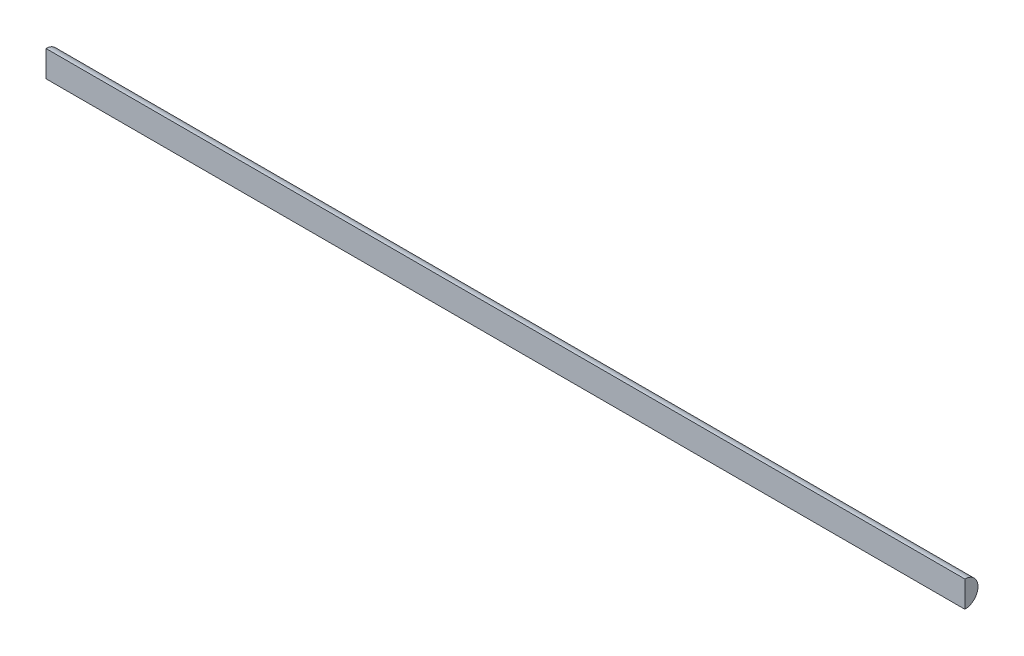
from build123d import *

# Parameters (mm, degrees)
BOSS_EXTRUDE1_DEPTH = 35


with BuildPart() as part:
    # Sketch1 → Boss-Extrude1 (new body)
    with BuildSketch(Plane(origin=(0, 0, 0), x_dir=(0, 0, -1), z_dir=(1, 0, 0))):
        with BuildLine():
            Line((0, 0.5), (0, -0.5))
            ThreePointArc((0, -0.5), (0.5, 0), (0, 0.5))
        make_face()
    extrude(amount=BOSS_EXTRUDE1_DEPTH)


solid = part.part
